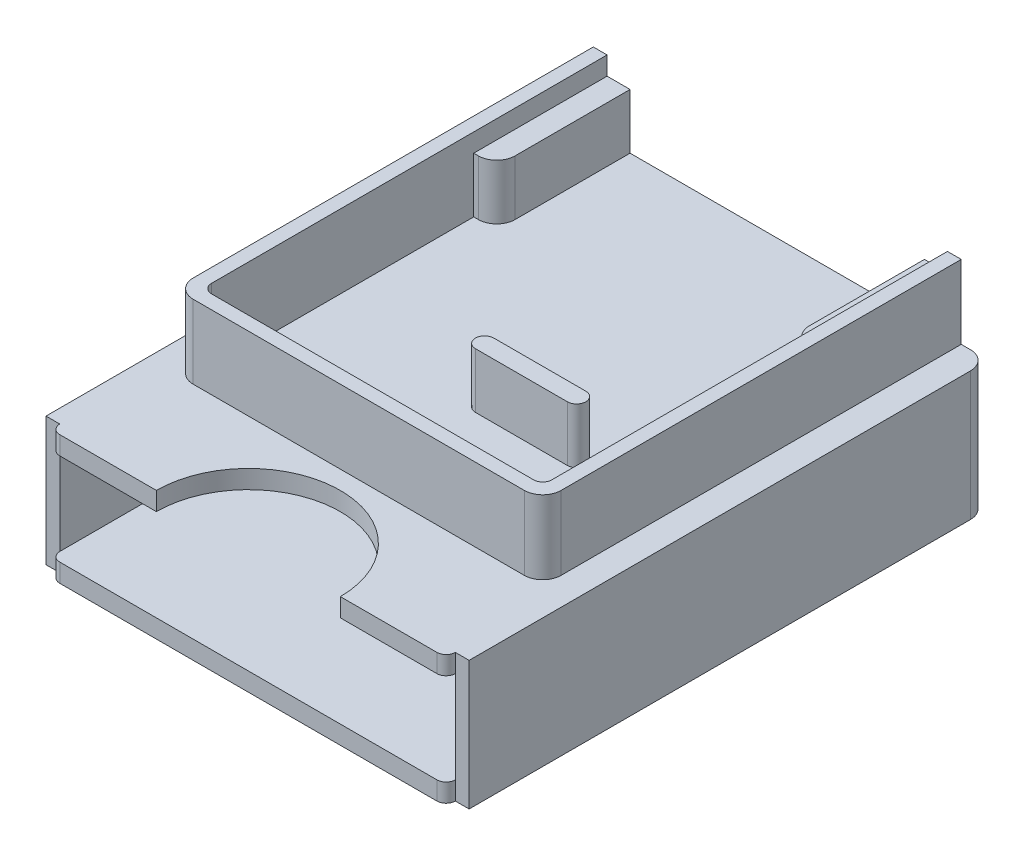
from build123d import *

# Parameters (mm, degrees)
BOSS_EXTRUDE23_DEPTH = 1
BOSS_EXTRUDE27_DEPTH = 6
BOSS_EXTRUDE28_START = 6
BOSS_EXTRUDE28_DEPTH = 1
CUT_EXTRUDE9_DEPTH   = 1
SKETCH15_W           = 10
SKETCH15_H           = 2
CUT_EXTRUDE11_DEPTH  = 10
BOSS_EXTRUDE30_DEPTH = 4
BOSS_EXTRUDE31_DEPTH = 3


with BuildPart() as part:
    # Sketch10 → Boss-Extrude23 (new body)
    with BuildSketch(Plane(origin=(0, 0, 0), x_dir=(1, 0, 0), z_dir=(0, 1, 0))):
        with BuildLine():
            Line((-11.5, -13.5), (-10.75, -13.5))
            ThreePointArc((-10.75, -13.5), (-10.603553391, -13.853553391), (-10.25, -14))
            Line((-10.25, -14), (10.25, -14))
            ThreePointArc((10.25, -14), (10.603553391, -13.853553391), (10.75, -13.5))
            Line((10.75, -13.5), (11.5, -13.5))
            Line((11.5, -13.5), (11.5, 13.75))
            ThreePointArc((11.5, 13.75), (11.207106781, 14.457106781), (10.5, 14.75))
            Line((10.5, 14.75), (-10.5, 14.75))
            ThreePointArc((-10.5, 14.75), (-11.207106781, 14.457106781), (-11.5, 13.75))
            Line((-11.5, 13.75), (-11.5, -13.5))
        make_face()
    extrude(amount=BOSS_EXTRUDE23_DEPTH)

    # Sketch10<6> → Boss-Extrude27 (add)
    with BuildSketch(Plane(origin=(0, 0, 0), x_dir=(1, 0, 0), z_dir=(0, 1, 0))):
        with BuildLine():
            Line((-11.5, -13.5), (-10.75, -13.5))
            Line((-10.75, -13.5), (-10.75, 13.5))
            ThreePointArc((-10.75, 13.5), (-10.603553391, 13.853553391), (-10.25, 14))
            Line((-10.25, 14), (10.25, 14))
            ThreePointArc((10.25, 14), (10.603553391, 13.853553391), (10.75, 13.5))
            Line((10.75, 13.5), (10.75, -13.5))
            Line((10.75, -13.5), (11.5, -13.5))
            Line((11.5, -13.5), (11.5, 13.75))
            ThreePointArc((11.5, 13.75), (11.207106781, 14.457106781), (10.5, 14.75))
            Line((10.5, 14.75), (4.75, 14.75))
            Line((4.75, 14.75), (-4.75, 14.75))
            Line((-4.75, 14.75), (-10.5, 14.75))
            ThreePointArc((-10.5, 14.75), (-11.207106781, 14.457106781), (-11.5, 13.75))
            Line((-11.5, 13.75), (-11.5, -13.5))
        make_face()
    extrude(amount=BOSS_EXTRUDE27_DEPTH)

    # Sketch10<7> → Boss-Extrude28 (add)
    with BuildSketch(Plane(origin=(0, 0, 0), x_dir=(1, 0, 0), z_dir=(0, 1, 0)).offset(BOSS_EXTRUDE28_START)):
        with BuildLine():
            Line((-11.5, -13.5), (-10.75, -13.5))
            ThreePointArc((-10.75, -13.5), (-10.603553391, -13.853553391), (-10.25, -14))
            Line((-10.25, -14), (10.25, -14))
            ThreePointArc((10.25, -14), (10.603553391, -13.853553391), (10.75, -13.5))
            Line((10.75, -13.5), (11.5, -13.5))
            Line((11.5, -13.5), (11.5, 13.75))
            ThreePointArc((11.5, 13.75), (11.207106781, 14.457106781), (10.5, 14.75))
            Line((10.5, 14.75), (-10.5, 14.75))
            ThreePointArc((-10.5, 14.75), (-11.207106781, 14.457106781), (-11.5, 13.75))
            Line((-11.5, 13.75), (-11.5, -13.5))
        make_face()
    extrude(amount=BOSS_EXTRUDE28_DEPTH)

    # Sketch13 → Cut-Extrude9 (cut)
    with BuildSketch(Plane(origin=(0, 7, 0), x_dir=(1, 0, 0), z_dir=(0, 1, 0))):
        with BuildLine():
            Line((-5, -14), (5, -14))
            ThreePointArc((5, -14), (0, -9), (-5, -14))
        make_face()
    extrude(amount=-CUT_EXTRUDE9_DEPTH, mode=Mode.SUBTRACT)

    # Sketch15 → Cut-Extrude11 (cut)
    with BuildSketch(Plane(origin=(0, 0, -14.75), x_dir=(-1, 0, 0), z_dir=(0, 0, -1))):
        with Locations((0, 2)):
            Rectangle(SKETCH15_W, SKETCH15_H)
    extrude(amount=-CUT_EXTRUDE11_DEPTH, mode=Mode.SUBTRACT)

    # Sketch17 → Boss-Extrude30 (add)
    with BuildSketch(Plane(origin=(0, 7, 0), x_dir=(1, 0, 0), z_dir=(0, 1, 0))):
        with BuildLine():
            Line((-9.25, -6.75), (-9.25, 14.75))
            Line((-9.25, 14.75), (-10, 14.75))
            Line((-10, 14.75), (-10, -7))
            ThreePointArc((-10, -7), (-9.707106781, -7.707106781), (-9, -8))
            Line((-9, -8), (9, -8))
            ThreePointArc((9, -8), (9.707106781, -7.707106781), (10, -7))
            Line((10, -7), (10, 14.75))
            Line((10, 14.75), (9.25, 14.75))
            Line((9.25, 14.75), (9.25, -6.75))
            ThreePointArc((9.25, -6.75), (9.103553391, -7.103553391), (8.75, -7.25))
            Line((8.75, -7.25), (-8.75, -7.25))
            ThreePointArc((-8.75, -7.25), (-9.103553391, -7.103553391), (-9.25, -6.75))
        make_face()
    extrude(amount=BOSS_EXTRUDE30_DEPTH)

    # Sketch18 → Boss-Extrude31 (add)
    with BuildSketch(Plane(origin=(0, 7, 0), x_dir=(1, 0, 0), z_dir=(0, 1, 0))):
        with BuildLine():
            ThreePointArc((8, 8.5), (8.292893219, 7.792893219), (9, 7.5))
            Line((9, 7.5), (9.25, 7.5))
            Line((9.25, 7.5), (9.25, 14.75))
            Line((9.25, 14.75), (8, 14.75))
            Line((8, 14.75), (8, 8.5))
        make_face()
        with BuildLine():
            Line((-8, 8.5), (-8, 14.75))
            Line((-8, 14.75), (-9.25, 14.75))
            Line((-9.25, 14.75), (-9.25, 7.5))
            Line((-9.25, 7.5), (-9, 7.5))
            ThreePointArc((-9, 7.5), (-8.292893219, 7.792893219), (-8, 8.5))
        make_face()
        with BuildLine():
            Line((0, -1.656788855), (5, -1.656788855))
            ThreePointArc((5, -1.656788855), (5.5, -1.156788855), (5, -0.656788855))
            Line((5, -0.656788855), (0, -0.656788855))
            ThreePointArc((0, -0.656788855), (-0.5, -1.156788855), (0, -1.656788855))
        make_face()
    extrude(amount=BOSS_EXTRUDE31_DEPTH)


solid = part.part
